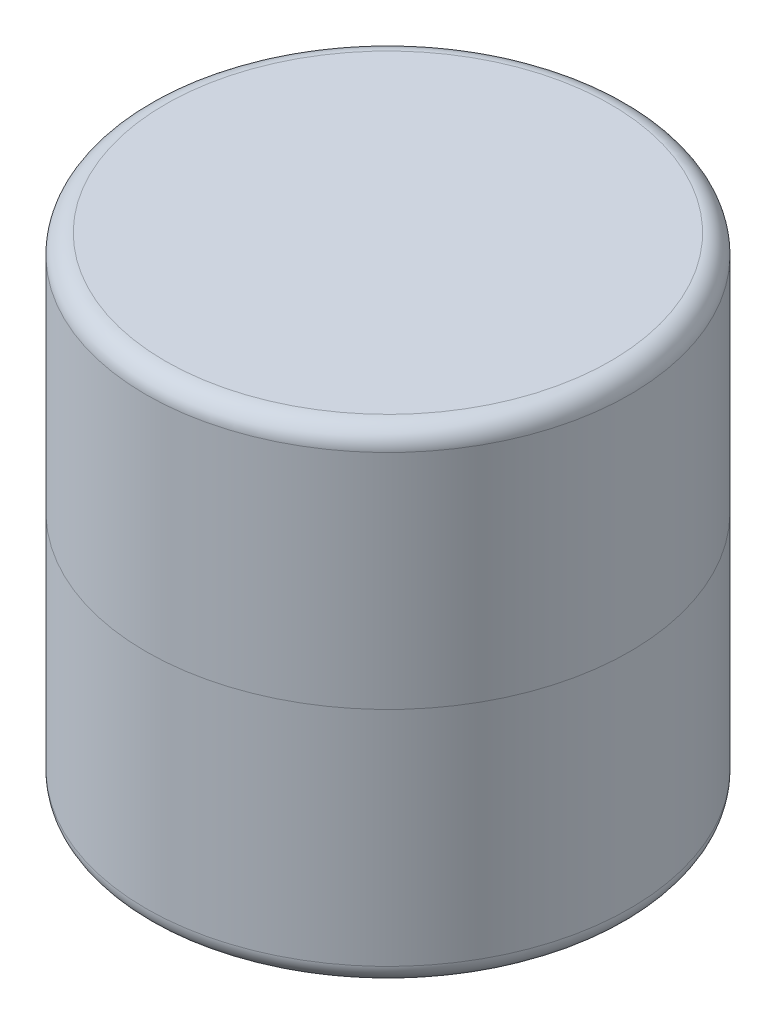
from build123d import *

# Parameters (mm, degrees)
SKETCH1_R           = 2.5
BOSS_EXTRUDE1_DEPTH = 2.5
FILLET1_R           = 0.2


with BuildPart() as part:
    # Sketch1 → Boss-Extrude1 (new body)
    with BuildSketch(Plane(origin=(0, 0, 0), x_dir=(1, 0, 0), z_dir=(0, 1, 0))):
        with Locations(Location((0, 0, 0), (0, 0, 270))):
            Circle(SKETCH1_R)
    extrude(amount=BOSS_EXTRUDE1_DEPTH)

    # Fillet1
    fillet1_edges = [part.edges().sort_by_distance(p)[0] for p in [
        (0, 0, -2.5),
    ]]
    fillet(fillet1_edges, radius=FILLET1_R)


with BuildPart() as body_2:
    # Mirror1: mirrored copy
    add(part.part.mirror(Plane.ZX.offset(2.5)))


solid = Compound([part.part, body_2.part])
